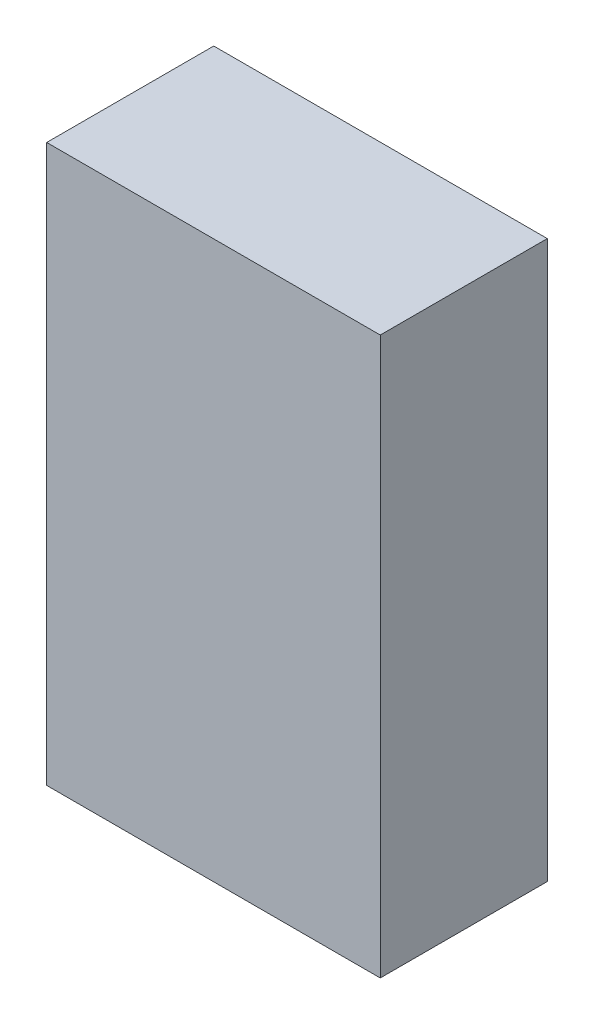
from build123d import *

# Parameters (mm, degrees)
SKETCH1_W           = 76.07554
SKETCH1_H           = 127
BOSS_EXTRUDE1_DEPTH = 38.1


with BuildPart() as part:
    # Sketch1 → Boss-Extrude1 (new body)
    with BuildSketch(Plane.XY):
        Rectangle(SKETCH1_W, SKETCH1_H)
    extrude(amount=BOSS_EXTRUDE1_DEPTH)


solid = part.part
